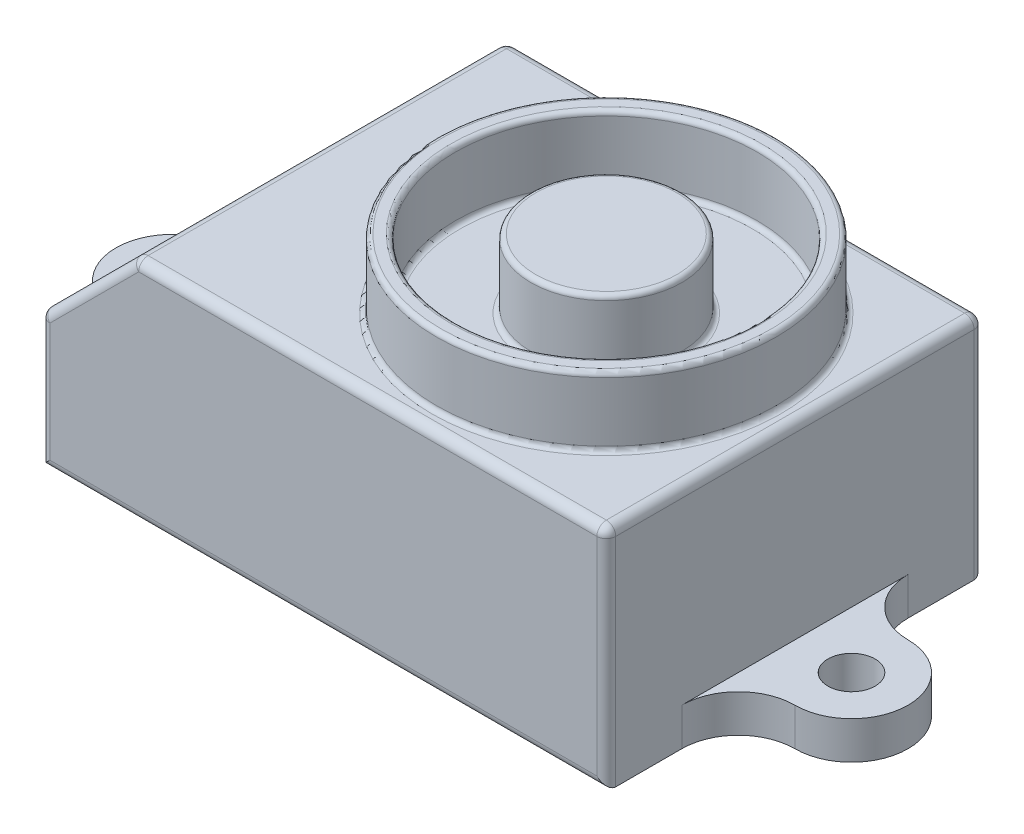
from build123d import *

# Parameters (mm, degrees)
ESBO_O1_W                = 30
ESBO_O1_H                = 20
ESBO_O1_R                = 9
RESSALTO_EXTRUS_O1_DEPTH = 12
ESBO_O1_3_R              = 9
ESBO_O1_3_R_2            = 8
ESBO_O1_3_R_3            = 4
RESSALTO_EXTRUS_O2_DEPTH = 15.65
ESBO_O1_4_R              = 1.25
RESSALTO_EXTRUS_O3_DEPTH = 2
ESBO_O1_5_R              = 1.25
CORTE_EXTRUS_O1_DEPTH    = 2
CORTE_EXTRUS_O2_START    = 15.65
ESBO_O1_6_R              = 8
ESBO_O1_6_R_2            = 4
CORTE_EXTRUS_O2_DEPTH    = 3.65
CHANFRO1_SIZE            = 5
FILETE1_R                = 0.5
FILETE2_R                = 0.25


with BuildPart() as part:
    # Esboço1 → Ressalto-extrusão1 (new body)
    with BuildSketch(Plane(origin=(0, 0, 0), x_dir=(1, 0, 0), z_dir=(0, 1, 0))):
        Rectangle(ESBO_O1_W, ESBO_O1_H)
        with Locations(Location((5, 0, 0), (0, 0, 270))):
            Circle(ESBO_O1_R, mode=Mode.SUBTRACT)
    extrude(amount=RESSALTO_EXTRUS_O1_DEPTH)

    # Esboço1<3> → Ressalto-extrusão2 (add)
    # profile 1 of 3: a face of its own
    with BuildSketch(Plane(origin=(0, 0, 0), x_dir=(1, 0, 0), z_dir=(0, 1, 0))):
        with Locations(Location((5, 0, 0), (0, 0, 270))):
            Circle(ESBO_O1_3_R)
        with Locations((5, 0)):
            Circle(ESBO_O1_3_R_2, mode=Mode.SUBTRACT)
    # profile 2 of 3: a face of its own
    with BuildSketch(Plane(origin=(0, 0, 0), x_dir=(1, 0, 0), z_dir=(0, 1, 0))):
        with Locations((5, 0)):
            Circle(ESBO_O1_3_R_2)
        with Locations((5, 0)):
            Circle(ESBO_O1_3_R_3, mode=Mode.SUBTRACT)
    # profile 3 of 3: a face of its own
    with BuildSketch(Plane(origin=(0, 0, 0), x_dir=(1, 0, 0), z_dir=(0, 1, 0))):
        with Locations((5, 0)):
            Circle(ESBO_O1_3_R_3)
    extrude(amount=RESSALTO_EXTRUS_O2_DEPTH)

    # Esboço1<4> → Ressalto-extrusão3 (add)
    # profile 1 of 4: a face of its own
    with BuildSketch(Plane(origin=(0, 0, 0), x_dir=(1, 0, 0), z_dir=(0, 1, 0))):
        with BuildLine():
            Line((-15, -6), (-15, 6))
            ThreePointArc((-15, 6), (-15.878679656, 3.878679656), (-18, 3))
            ThreePointArc((-18, 3), (-21, 0), (-18, -3))
            ThreePointArc((-18, -3), (-15.878679656, -3.878679656), (-15, -6))
        make_face()
        with Locations((-18, 0)):
            Circle(ESBO_O1_4_R, mode=Mode.SUBTRACT)
    # profile 2 of 4: a face of its own
    with BuildSketch(Plane(origin=(0, 0, 0), x_dir=(1, 0, 0), z_dir=(0, 1, 0))):
        with Locations((-18, 0)):
            Circle(ESBO_O1_4_R)
    # profile 3 of 4: a face of its own
    with BuildSketch(Plane(origin=(0, 0, 0), x_dir=(1, 0, 0), z_dir=(0, 1, 0))):
        with BuildLine():
            ThreePointArc((18, 3), (15.878679656, 3.878679656), (15, 6))
            Line((15, 6), (15, -6))
            ThreePointArc((15, -6), (15.878679656, -3.878679656), (18, -3))
            ThreePointArc((18, -3), (21, 0), (18, 3))
        make_face()
        with Locations((18, 0)):
            Circle(ESBO_O1_4_R, mode=Mode.SUBTRACT)
    # profile 4 of 4: a face of its own
    with BuildSketch(Plane(origin=(0, 0, 0), x_dir=(1, 0, 0), z_dir=(0, 1, 0))):
        with Locations((18, 0)):
            Circle(ESBO_O1_4_R)
    extrude(amount=RESSALTO_EXTRUS_O3_DEPTH)

    # Esboço1<5> → Corte-extrusão1 (cut)
    with BuildSketch(Plane(origin=(0, 0, 0), x_dir=(1, 0, 0), z_dir=(0, 1, 0))):
        with Locations(Location((18, 0, 0), (0, 0, 270))):
            Circle(ESBO_O1_5_R)
        with Locations(Location((-18, 0, 0), (0, 0, 270))):
            Circle(ESBO_O1_5_R)
    extrude(amount=CORTE_EXTRUS_O1_DEPTH, mode=Mode.SUBTRACT)

    # Esboço1<6> → Corte-extrusão2 (cut)
    with BuildSketch(Plane(origin=(0, 0, 0), x_dir=(1, 0, 0), z_dir=(0, 1, 0)).offset(CORTE_EXTRUS_O2_START)):
        with Locations(Location((5, 0, 0), (0, 0, 270))):
            Circle(ESBO_O1_6_R)
        with Locations(Location((5, 0, 0), (0, 0, 270))):
            Circle(ESBO_O1_6_R_2, mode=Mode.SUBTRACT)
    extrude(amount=-CORTE_EXTRUS_O2_DEPTH, mode=Mode.SUBTRACT)

    # Chanfro1
    chanfro1_edges = [part.edges().sort_by_distance(p)[0] for p in [
        (-15, 12, 0),
    ]]
    chamfer(chanfro1_edges, length=CHANFRO1_SIZE)

    # Filete1
    filete1_edges = [part.edges().sort_by_distance(p)[0] for p in [
        (15, 6, 10),
        (15, 6, -10),
        (15, 12, 0),
        (2.5, 12, -10),
        (2.5, 12, 10),
        (-10, 12, 0),
        (-15, 3.5, 10),
        (-12.5, 9.5, 10),
        (-15, 3.5, -10),
        (-15, 7, 0),
        (-12.5, 9.5, -10),
        (0, 0, 10),
        (0, 0, -10),
    ]]
    fillet(filete1_edges, radius=FILETE1_R)

    # Filete2
    filete2_edges = [part.edges().sort_by_distance(p)[0] for p in [
        (5, 15.65, -9),
        (5, 12, -8),
        (5, 12, -4),
        (5, 15.65, -8),
        (5, 15.65, -4),
        (5, 12, -9),
    ]]
    fillet(filete2_edges, radius=FILETE2_R)


solid = part.part
